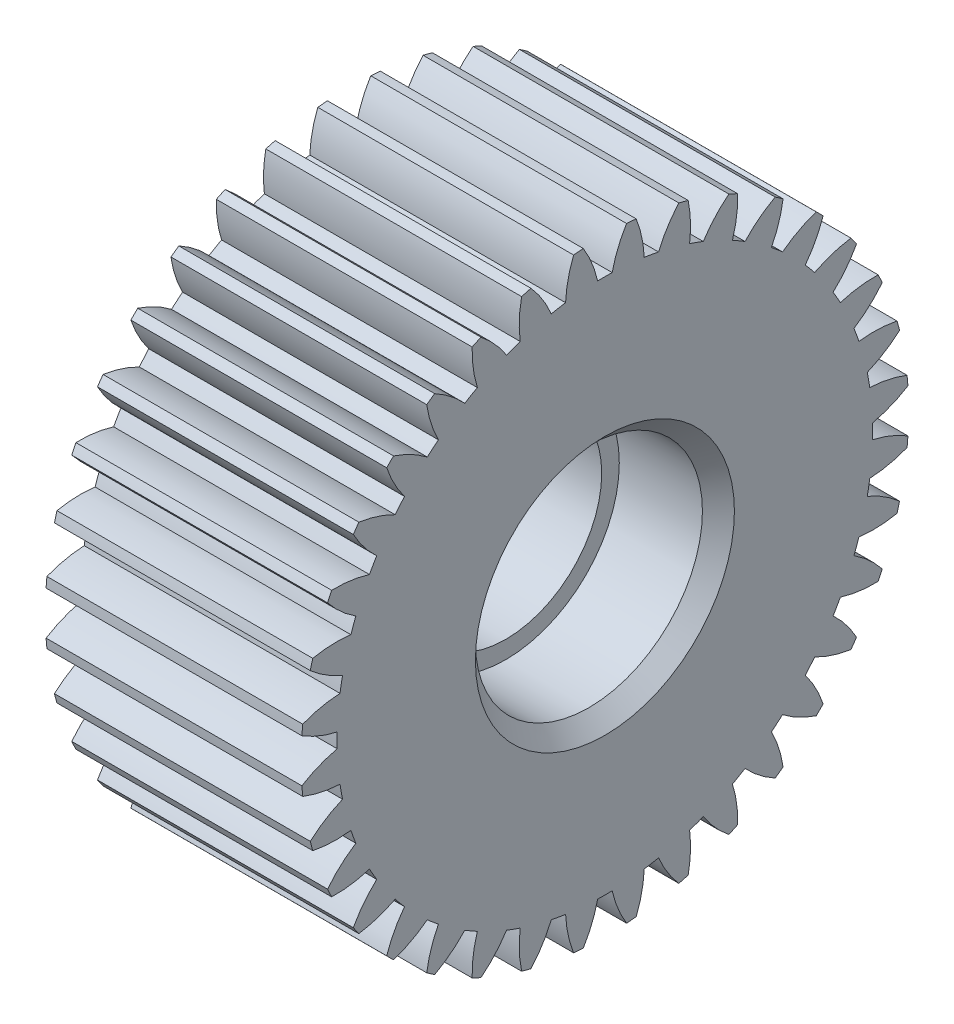
from build123d import *

# Parameters (mm, degrees)
BASPROSKE_W     = 8
BASPROSKE_H     = 9.5
TOOTHCUT_DEPTH  = 16.636495771
TEETHCUTS_COUNT = 36
TEETHCUTS_ANGLE = 350
BORSKE_R        = 1
BORE_DEPTH      = 50.0000508
CHAMFER1_SIZE   = 0.5


with BuildPart() as part:
    # BasProSke → Base-Revolve (revolve)
    with BuildSketch(Plane(origin=(0, 0, 0), x_dir=(1, 0, 0), z_dir=(0, 1, 0)), mode=Mode.PRIVATE) as base_revolve_sk:
        with Locations((4, 4.75)):
            Rectangle(BASPROSKE_W, BASPROSKE_H)
    revolve(base_revolve_sk.sketch.rotate(Axis((-10, 0, 0), (1, 0, 0)), 180), axis=Axis((-10, 0, 0), (1, 0, 0)))

    # TooCutSke → ToothCut (cut, through all)
    with BuildSketch(Plane(origin=(0, 0, 0), x_dir=(0, 0, -1), z_dir=(1, 0, 0))):
        with BuildLine():
            ThreePointArc((0.227221176, 8.370916708), (0, 8.374), (-0.227221176, 8.370916708))
            ThreePointArc((-0.227221176, 8.370916708), (-0.411410437, 8.955426484), (-0.69207336, 9.500225241))
            ThreePointArc((-0.69207336, 9.500225241), (0, 9.5254), (0.69207336, 9.500225241))
            ThreePointArc((0.69207336, 9.500225241), (0.411410437, 8.955426484), (0.227221176, 8.370916708))
        make_face()
    toothcut = extrude(amount=TOOTHCUT_DEPTH, mode=Mode.SUBTRACT)

    # TeethCuts: ToothCut ×36 about axis
    teethcuts_axis = Axis((-10, 0, 0), (1, 0, 0))
    for i in range(1, TEETHCUTS_COUNT):
        add(toothcut.rotate(teethcuts_axis, i * TEETHCUTS_ANGLE / (TEETHCUTS_COUNT - 1)), mode=Mode.SUBTRACT)

    # BorSke → Bore (cut, symmetric)
    with BuildSketch(Plane(origin=(0, 0, 0), x_dir=(0, 0, -1), z_dir=(1, 0, 0))):
        with Locations(Location((0, 0, 0), (0, 0, 180))):
            Circle(BORSKE_R)
    extrude(amount=BORE_DEPTH, both=True, mode=Mode.SUBTRACT)

    # Sketch1 → Cut-Revolve1 (revolve, cut)
    with BuildSketch(Plane(origin=(0, 0, 0), x_dir=(1, 0, 0), z_dir=(0, 1, 0))):
        Polygon((0, 3), (4.9, 3), (4.9, 3.55), (8, 3.55), (8, 0), (0, 0), align=None)
    revolve(axis=Axis((-4.672305985, 0, 0), (-1, 0, 0)), mode=Mode.SUBTRACT)

    # Chamfer1
    chamfer1_edges = [part.edges().sort_by_distance(p)[0] for p in [
        (8, 0, 3.55),
    ]]
    chamfer(chamfer1_edges, length=CHAMFER1_SIZE)


solid = part.part
